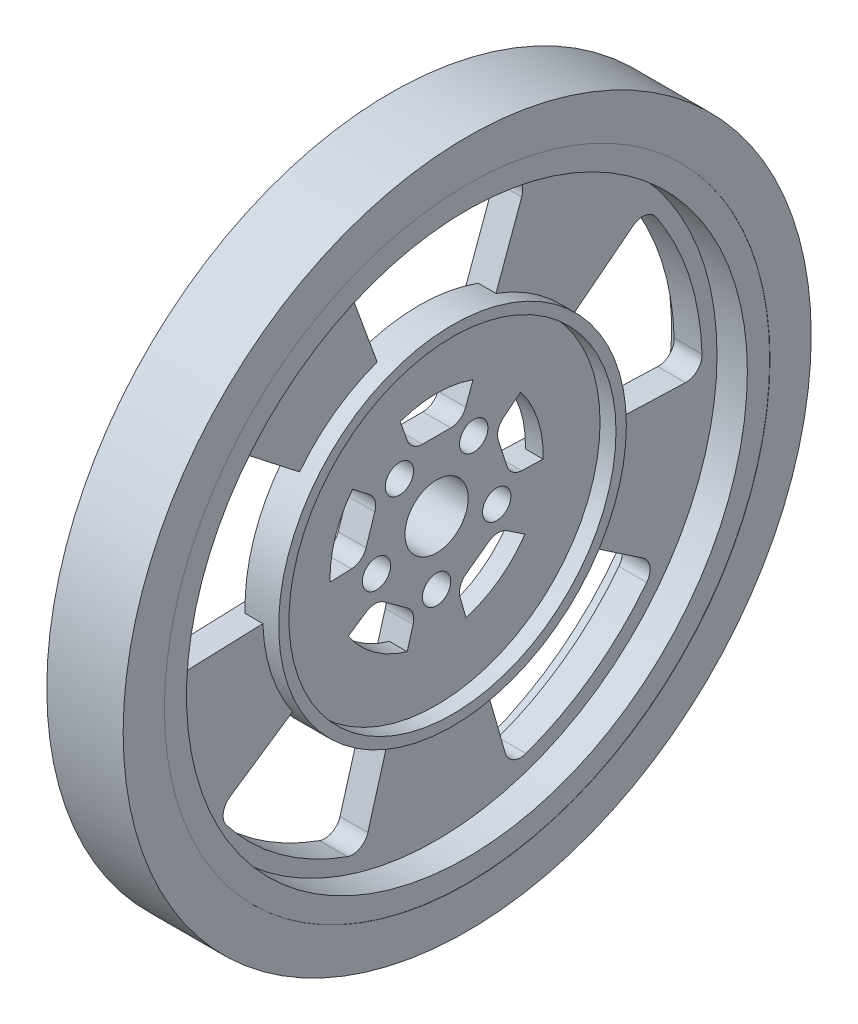
from build123d import *

# Parameters (mm, degrees)
SKETCH1_R                = 34.544
BOSS_EXTRUDE1_DEPTH      = 7.62
SKETCH2_R                = 28.1686
CUT_EXTRUDE1_DEPTH       = 3.048
CUT_EXTRUDE2_START       = -1.778
SKETCH3_R                = 28.1686
SKETCH3_R_2              = 4.3688
CUT_EXTRUDE2_DEPTH       = 1.778
CUT_EXTRUDE3_DEPTH       = 50.200658898
FILLET1_R                = 1.6002
CIRPATTERN1_COUNT        = 5
FILLET1_OF_CIRPATTERN1_R = 1.6002
SKETCH5_R                = 17.4625
SKETCH5_R_2              = 10.7061
BOSS_EXTRUDE2_DEPTH      = 1.778
BOSS_EXTRUDE4_START      = 1.6002
SKETCH6_R                = 17.4625
SKETCH6_R_2              = 16.4211
BOSS_EXTRUDE4_DEPTH      = 1.6002
SKETCH7_R                = 3.175
CUT_EXTRUDE4_DEPTH       = 50.066068275
SKETCH8_R                = 1.4224
CUT_EXTRUDE5_DEPTH       = 50.066068275
CIRPATTERN2_COUNT        = 5
BOSS_EXTRUDE5_DEPTH      = 0.0254
BOSS_EXTRUDE5_DEPTH_BACK = 7.6454
SKETCH9_R                = 34.5567
SKETCH9_R_2              = 30.4165
SCALE_1_SCALE            = 3


with BuildPart() as part:
    # Sketch1 → Boss-Extrude1 (new body)
    with BuildSketch(Plane(origin=(0, 0, 0), x_dir=(0, 0, -1), z_dir=(1, 0, 0))):
        with Locations(Location((0, 0, 0), (0, 0, 180))):
            Circle(SKETCH1_R)
    extrude(amount=BOSS_EXTRUDE1_DEPTH)

    # Sketch2 → Cut-Extrude1 (cut)
    with BuildSketch(Plane(origin=(7.62, 0, 0), x_dir=(0, 0, -1), z_dir=(1, 0, 0))):
        Circle(SKETCH2_R)
    extrude(amount=-CUT_EXTRUDE1_DEPTH, mode=Mode.SUBTRACT)

    # Sketch3 → Cut-Extrude2 (cut)
    with BuildSketch(Plane.ZY.offset(CUT_EXTRUDE2_START)):
        with Locations(Location((0, 0, 0), (0, 0, 180))):
            Circle(SKETCH3_R)
        Circle(SKETCH3_R_2, mode=Mode.SUBTRACT)
    extrude(amount=CUT_EXTRUDE2_DEPTH, mode=Mode.SUBTRACT)

    # Sketch4 → Cut-Extrude3 (cut, through all)
    with BuildSketch(Plane.ZY.offset(-1.778)):
        with BuildLine():
            Line((-2.54, 6.985), (2.54, 6.985))
            Line((2.54, 6.985), (9.114287493, 25.064290604))
            ThreePointArc((9.114287493, 25.064290604), (0, 26.67), (-9.114287493, 25.064290604))
            Line((-9.114287493, 25.064290604), (-2.54, 6.985))
        make_face()
    cut_extrude3 = extrude(amount=-CUT_EXTRUDE3_DEPTH, mode=Mode.SUBTRACT)

    # Fillet1
    fillet1_edges = [part.edges().sort_by_distance(p)[0] for p in [
        (3.175, 25.064290604, 9.114287493),
        (3.175, 6.985, 2.54),
        (3.175, 6.985, -2.54),
        (3.175, 25.064290604, -9.114287493),
    ]]
    fillet(fillet1_edges, radius=FILLET1_R)

    # CirPattern1: Cut-Extrude3 ×5 about axis
    cirpattern1_axis = Axis((0, 0, 0), (1, 0, 0))
    for i in range(1, CIRPATTERN1_COUNT):
        add(cut_extrude3.rotate(cirpattern1_axis, i * 360 / CIRPATTERN1_COUNT), mode=Mode.SUBTRACT)

    # Fillet1 of CirPattern1
    fillet1_of_cirpattern1_edges = [part.edges().sort_by_distance(p)[0] for p in [
        (3.175, -0.922910762, 26.654026632),
        (3.175, -0.257199846, 7.428032932),
        (3.175, 4.574167257, 5.858226601),
        (3.175, 16.41349426, 21.021087179),
        (3.175, -25.634680824, 7.358806903),
        (3.175, -7.143958247, 2.050776822),
        (3.175, -4.158009165, 6.160583153),
        (3.175, -14.920193278, 22.10603385),
        (3.175, -14.920193278, -22.10603385),
        (3.175, -4.158009165, -6.160583153),
        (3.175, -7.143958247, -2.050776822),
        (3.175, -25.634680824, -7.358806903),
        (3.175, 16.41349426, -21.021087179),
        (3.175, 4.574167257, -5.858226601),
        (3.175, -0.257199846, -7.428032932),
        (3.175, -0.922910762, -26.654026632),
    ]]
    fillet(fillet1_of_cirpattern1_edges, radius=FILLET1_OF_CIRPATTERN1_R)

    # Sketch5 → Boss-Extrude2 (add)
    with BuildSketch(Plane(origin=(4.572, 0, 0), x_dir=(0, 0, -1), z_dir=(1, 0, 0))):
        Circle(SKETCH5_R)
        Circle(SKETCH5_R_2, mode=Mode.SUBTRACT)
    extrude(amount=-BOSS_EXTRUDE2_DEPTH)

    # Sketch6 → Boss-Extrude4 (add)
    with BuildSketch(Plane(origin=(4.572, 0, 0), x_dir=(0, 0, -1), z_dir=(1, 0, 0)).offset(BOSS_EXTRUDE4_START)):
        Circle(SKETCH6_R)
        Circle(SKETCH6_R_2, mode=Mode.SUBTRACT)
    extrude(amount=-BOSS_EXTRUDE4_DEPTH)

    # Sketch7 → Cut-Extrude4 (cut, through all)
    with BuildSketch(Plane(origin=(4.572, 0, 0), x_dir=(0, 0, -1), z_dir=(1, 0, 0))):
        Circle(SKETCH7_R)
    extrude(amount=-CUT_EXTRUDE4_DEPTH, mode=Mode.SUBTRACT)

    # Sketch8 → Cut-Extrude5 (cut, through all)
    with BuildSketch(Plane(origin=(4.572, 0, 0), x_dir=(0, 0, -1), z_dir=(1, 0, 0))):
        with Locations((0, -6.35)):
            Circle(SKETCH8_R)
    cut_extrude5 = extrude(amount=-CUT_EXTRUDE5_DEPTH, mode=Mode.SUBTRACT)

    # CirPattern2: Cut-Extrude5 ×5 about axis
    cirpattern2_axis = Axis((0, 0, 0), (1, 0, 0))
    for i in range(1, CIRPATTERN2_COUNT):
        add(cut_extrude5.rotate(cirpattern2_axis, i * 360 / CIRPATTERN2_COUNT), mode=Mode.SUBTRACT)

    # Sketch9 → Boss-Extrude5 (add, two sides: drawn at the far end of the back side and taken through both)
    with BuildSketch(Plane(origin=(7.62, 0, 0), x_dir=(0, 0, -1), z_dir=(1, 0, 0)).offset(-BOSS_EXTRUDE5_DEPTH_BACK)):
        Circle(SKETCH9_R)
        Circle(SKETCH9_R_2, mode=Mode.SUBTRACT)
    extrude(amount=BOSS_EXTRUDE5_DEPTH + BOSS_EXTRUDE5_DEPTH_BACK)


with BuildPart() as part_1:
    # 缩放比例1: scaled about (0, 0, 0)
    add(part.part.scale(SCALE_1_SCALE))


solid = part_1.part
